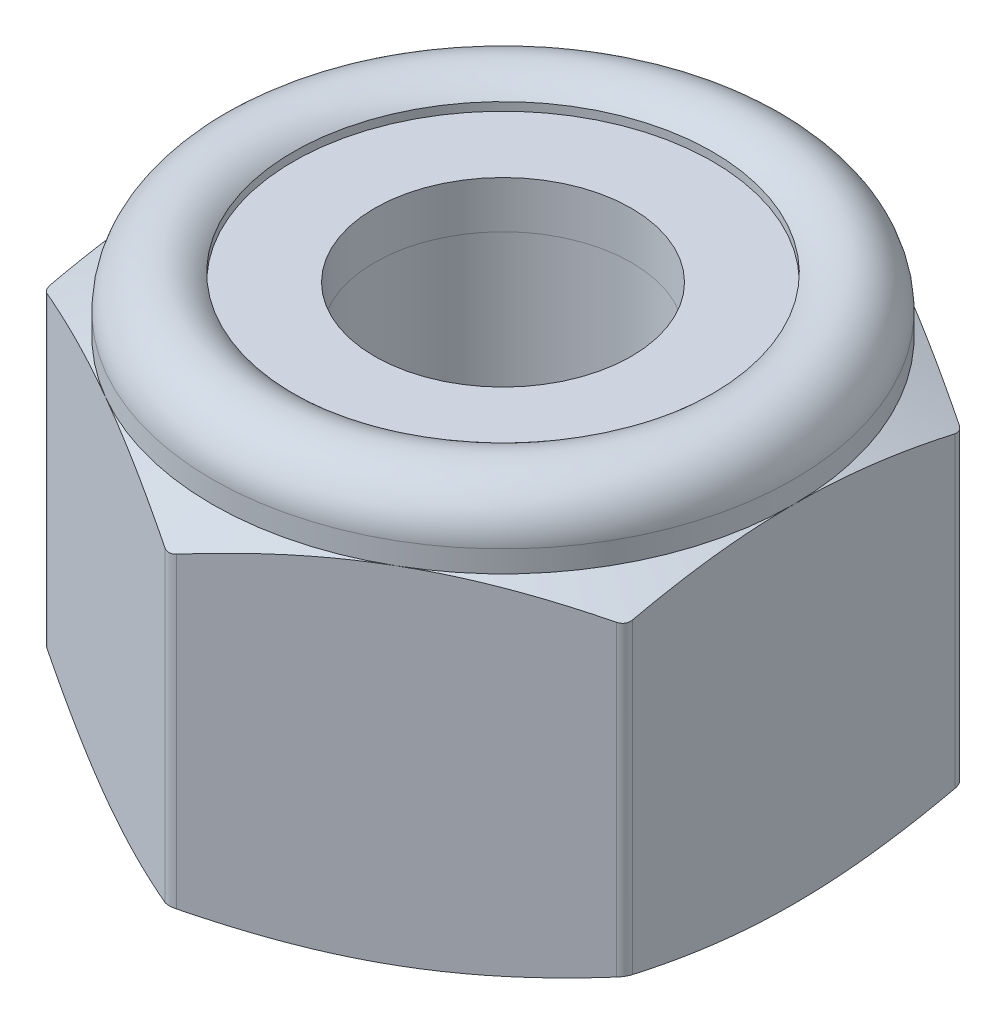
from build123d import *

# Parameters (mm, degrees)
BOSS_EXTRUDE1_DEPTH      = 2.5
BOSS_EXTRUDE1_DEPTH_BACK = 2.5
SKETCH2_R                = 1.545336663
FILLET1_R                = 0.14
SKETCH4_W                = 0.977331669
SKETCH4_H                = 0.565649729


with BuildPart() as part:
    # Sketch2 → Boss-Extrude1 (new, two sides: drawn at the far end of the back side and taken through both)
    with BuildSketch(Plane(origin=(0, 0, 0), x_dir=(1, 0, 0), z_dir=(0, 1, 0)).offset(-BOSS_EXTRUDE1_DEPTH_BACK)):
        Polygon((0, 4.041451884), (-3.5, 2.020725942), (-3.5, -2.020725942), (0, -4.041451884), (3.5, -2.020725942), (3.5, 2.020725942), align=None)
        with Locations(Location((0, 0, 0), (0, 0, 270))):
            Circle(SKETCH2_R, mode=Mode.SUBTRACT)
    extrude(amount=BOSS_EXTRUDE1_DEPTH + BOSS_EXTRUDE1_DEPTH_BACK)

    # Fillet1
    fillet1_edges = [part.edges().sort_by_distance(p)[0] for p in [
        (3.5, 0, -2.020725942),
        (3.5, 0, 2.020725942),
        (0, 0, 4.041451884),
        (-3.5, 0, 2.020725942),
        (-3.5, 0, -2.020725942),
        (0, 0, -4.041451884),
    ]]
    fillet(fillet1_edges, radius=FILLET1_R)

    # Sketch3 → Cut-Revolve2 (revolve, cut)
    with BuildSketch(Plane(origin=(0, 0, 0), x_dir=(0, 0, -1), z_dir=(1, 0, 0)), mode=Mode.PRIVATE) as cut_revolve2_sk:
        with BuildLine():
            Line((4.041451884, 1.666666667), (4.041451884, 3.5))
            Line((4.041451884, 3.5), (1.545336663, 3.5))
            Line((1.545336663, 3.5), (1.545336663, 1.666666667))
            Line((1.545336663, 1.666666667), (2.522668332, 1.666666667))
            Line((2.522668332, 1.666666667), (2.522668332, 2.332316396))
            ThreePointArc((2.522668332, 2.332316396), (3.146581551, 2.456420451), (3.5, 1.927492364))
            Line((3.5, 1.927492364), (3.5, 1.666666667))
            Line((3.5, 1.666666667), (4.041451884, 1.414183506))
            Line((4.041451884, 1.414183506), (4.041451884, 1.666666667))
        make_face()
        Polygon((3.5, -2.5), (4.041451884, -2.24751684), (4.041451884, -2.5), align=None)
        Polygon((1.545336663, -2.5), (1.545336663, -2.1), (1.945336663, -2.5), align=None)
    revolve(cut_revolve2_sk.sketch.rotate(Axis((0, -2.5, 0), (0, 1, 0)), 270), axis=Axis((0, -2.5, 0), (0, 1, 0)), mode=Mode.SUBTRACT)


with BuildPart() as body_2:
    # Sketch4 → Revolve1 (revolve)
    with BuildSketch(Plane(origin=(0, 0, 0), x_dir=(0, 0, -1), z_dir=(1, 0, 0)), mode=Mode.PRIVATE) as revolve1_sk:
        with Locations((-2.034002498, 1.949491532)):
            Rectangle(SKETCH4_W, SKETCH4_H)
    revolve(revolve1_sk.sketch.rotate(Axis((0, -2.5, 0), (0, 1, 0)), 90), axis=Axis((0, -2.5, 0), (0, 1, 0)))


solid = Compound([part.part, body_2.part])
